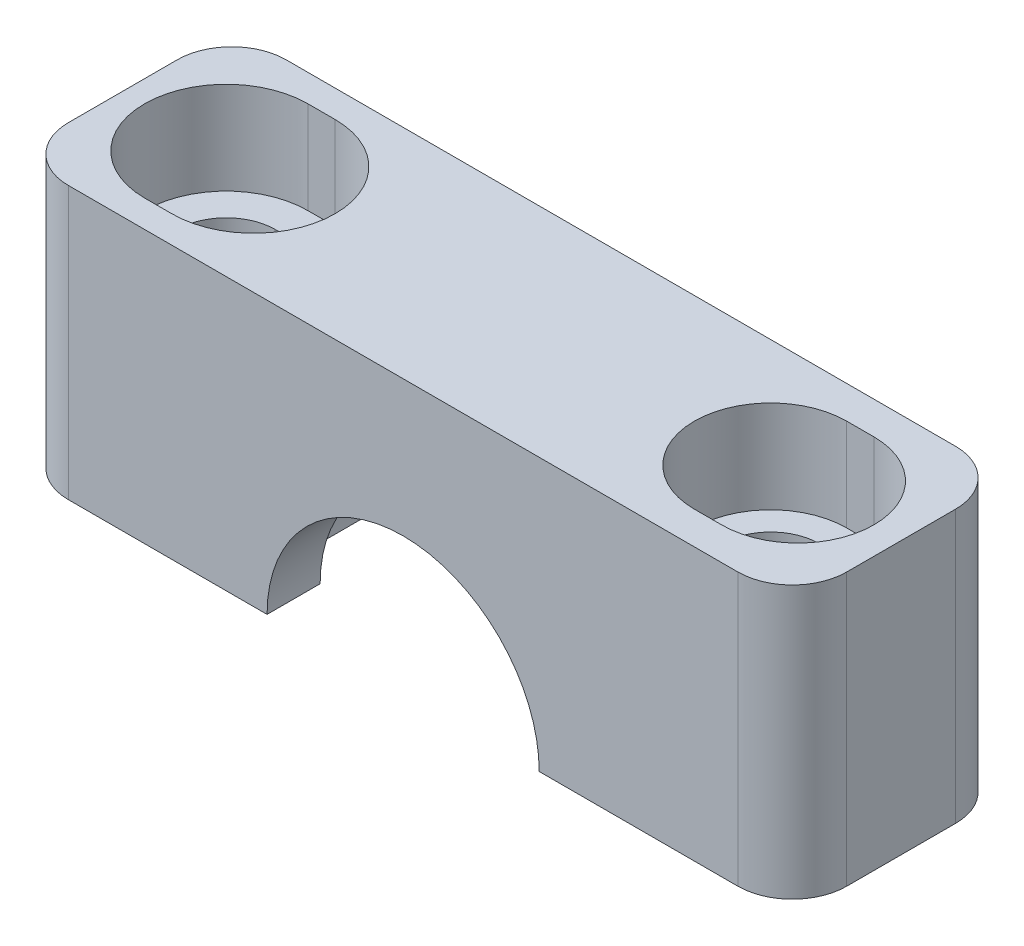
from build123d import *

# Parameters (mm, degrees)
BOSS_EXTRUDE1_DEPTH = 12.7
CUT_EXTRUDE1_DEPTH  = 25.379038558
CUT_EXTRUDE2_DEPTH  = 2.6035
CUT_EXTRUDE3_DEPTH  = 23.735837812
CUT_EXTRUDE4_DEPTH  = 4.318


with BuildPart() as part:
    # Sketch1 → Boss-Extrude1 (new body)
    with BuildSketch(Plane(origin=(0, 0, 0), x_dir=(1, 0, 0), z_dir=(0, 1, 0))):
        with BuildLine():
            Line((-15.621, -5.08), (15.621, -5.08))
            ThreePointArc((15.621, -5.08), (17.417051224, -4.336051224), (18.161, -2.54))
            Line((18.161, -2.54), (18.161, 2.54))
            ThreePointArc((18.161, 2.54), (17.417051224, 4.336051224), (15.621, 5.08))
            Line((15.621, 5.08), (-15.621, 5.08))
            ThreePointArc((-15.621, 5.08), (-17.417051224, 4.336051224), (-18.161, 2.54))
            Line((-18.161, 2.54), (-18.161, -2.54))
            ThreePointArc((-18.161, -2.54), (-17.417051224, -4.336051224), (-15.621, -5.08))
        make_face()
    extrude(amount=BOSS_EXTRUDE1_DEPTH)

    # Sketch2 → Cut-Extrude1 (cut, through all)
    with BuildSketch(Plane.XY.offset(5.08)):
        with BuildLine():
            Line((-6.35, 0), (6.35, 0))
            ThreePointArc((6.35, 0), (0, 6.35), (-6.35, 0))
        make_face()
    extrude(amount=-CUT_EXTRUDE1_DEPTH, mode=Mode.SUBTRACT)

    # Sketch3 → Cut-Extrude2 (cut, symmetric)
    with BuildSketch(Plane.XY):
        with BuildLine():
            Line((-8.001, 0), (8.001, 0))
            ThreePointArc((8.001, 0), (0, 8.001), (-8.001, 0))
        make_face()
    extrude(amount=CUT_EXTRUDE2_DEPTH, both=True, mode=Mode.SUBTRACT)

    # Sketch4 → Cut-Extrude3 (cut, through all)
    with BuildSketch(Plane.XZ):
        with BuildLine():
            Line((12.065, 2.286), (13.335, 2.286))
            ThreePointArc((13.335, 2.286), (15.621, 0), (13.335, -2.286))
            Line((13.335, -2.286), (12.065, -2.286))
            ThreePointArc((12.065, -2.286), (9.779, 0), (12.065, 2.286))
        make_face()
        with BuildLine():
            Line((-13.335, 2.286), (-12.065, 2.286))
            ThreePointArc((-12.065, 2.286), (-9.779, 0), (-12.065, -2.286))
            Line((-12.065, -2.286), (-13.335, -2.286))
            ThreePointArc((-13.335, -2.286), (-15.621, 0), (-13.335, 2.286))
        make_face()
    extrude(amount=-CUT_EXTRUDE3_DEPTH, mode=Mode.SUBTRACT)

    # Sketch5 → Cut-Extrude4 (cut)
    with BuildSketch(Plane(origin=(0, 12.7, 0), x_dir=(1, 0, 0), z_dir=(0, 1, 0))):
        with BuildLine():
            Line((-12.065, 3.81), (-13.335, 3.81))
            ThreePointArc((-13.335, 3.81), (-17.145, 0), (-13.335, -3.81))
            Line((-13.335, -3.81), (-12.065, -3.81))
            ThreePointArc((-12.065, -3.81), (-8.255, 0), (-12.065, 3.81))
        make_face()
        with BuildLine():
            Line((12.065, -3.556), (13.335, -3.556))
            ThreePointArc((13.335, -3.556), (16.891, 0), (13.335, 3.556))
            Line((13.335, 3.556), (12.065, 3.556))
            ThreePointArc((12.065, 3.556), (8.509, 0), (12.065, -3.556))
        make_face()
    extrude(amount=-CUT_EXTRUDE4_DEPTH, mode=Mode.SUBTRACT)


solid = part.part
